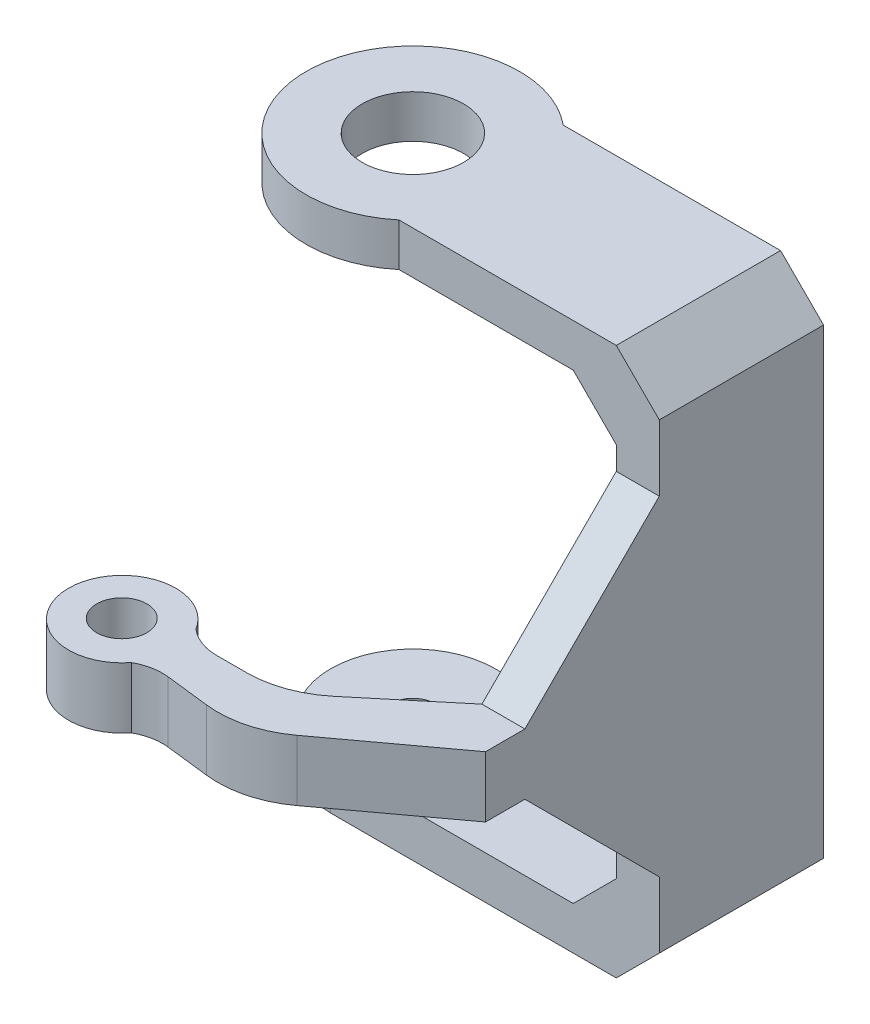
from build123d import *

# Parameters (mm, degrees)
BOSS_EXTRUDE1_DEPTH      = 5.73
BOSS_EXTRUDE1_DEPTH_BACK = 5.73
BOSS_EXTRUDE2_DEPTH      = 11.46
BOSS_EXTRUDE3_DEPTH      = 11.46
BOSS_EXTRUDE4_DEPTH      = 2.999321
SKETCH7_R                = 3.54
CUT_EXTRUDE2_DEPTH       = 2.999322
BOSS_EXTRUDE5_DEPTH      = 3
SKETCH11_R               = 1.52
CUT_EXTRUDE3_DEPTH       = 3
BOSS_EXTRUDE6_DEPTH      = 3.000001
BOSS_EXTRUDE7_DEPTH      = 4.24753
SKETCH15_R               = 1.75
CUT_EXTRUDE4_DEPTH       = 4.24753


with BuildPart() as part:
    # Sketch1 → Boss-Extrude1 (new, two sides: drawn at the far end of the back side and taken through both)
    with BuildSketch(Plane.XY.offset(-BOSS_EXTRUDE1_DEPTH_BACK)):
        Polygon((32.166139185, 36.798009468), (35.166138746, 39.798007166), (38.166139237, 36.798004811), (38.166139237, 4.578006273), (35.166137814, 1.578006712), (32.166137322, 4.578009067), (35.166137814, 7.578007696), (35.166137814, 33.798008976), align=None)
    extrude(amount=BOSS_EXTRUDE1_DEPTH + BOSS_EXTRUDE1_DEPTH_BACK)

    # Sketch2 → Boss-Extrude2 (add)
    with BuildSketch(Plane.XY.offset(5.73)):
        Polygon((32.166139185, 36.798009468), (20.006139185, 36.798009468), (20.006139185, 39.797331447), (32.166139185, 39.797331447), (35.165463026, 39.797331447), align=None)
    extrude(amount=-BOSS_EXTRUDE2_DEPTH)

    # Sketch3 → Boss-Extrude3 (add)
    with BuildSketch(Plane.XY.offset(5.73)):
        Polygon((32.166137322, 4.578009067), (35.166137814, 1.578006712), (32.166137322, 1.578006712), (20.006137322, 1.578006712), (20.006137322, 4.578009067), align=None)
    extrude(amount=-BOSS_EXTRUDE3_DEPTH)

    # Sketch4 → Boss-Extrude4 (add)
    with BuildSketch(Plane(origin=(0, 39.797331447, 0), x_dir=(1, 0, 0), z_dir=(0, 1, 0))):
        with BuildLine():
            Line((20.006139185, 5.73), (20.006139185, -5.73))
            ThreePointArc((20.006139185, -5.73), (7.794878848, 0), (20.006139185, 5.73))
        make_face()
    extrude(amount=-BOSS_EXTRUDE4_DEPTH)

    # Sketch7 → Cut-Extrude2 (cut)
    with BuildSketch(Plane(origin=(0, 39.797331447, 0), x_dir=(1, 0, 0), z_dir=(0, 1, 0))):
        with Locations(Location((15.244878848, 0, 0), (0, 0, 270))):
            Circle(SKETCH7_R)
    extrude(amount=-CUT_EXTRUDE2_DEPTH, mode=Mode.SUBTRACT)

    # Sketch9 → Boss-Extrude5 (add)
    with BuildSketch(Plane(origin=(0, 1.578006712, 0), x_dir=(-1, 0, 0), z_dir=(0, -1, 0))):
        with BuildLine():
            Line((-20.006139185, -5.73), (-15.244878848, -5.73))
            ThreePointArc((-15.244878848, -5.73), (-9.514878848, 0), (-15.244878848, 5.73))
            Line((-15.244878848, 5.73), (-20.006137322, 5.73))
            Line((-20.006137322, 5.73), (-20.006139185, -5.73))
        make_face()
    extrude(amount=-BOSS_EXTRUDE5_DEPTH)

    # Sketch11 → Cut-Extrude3 (cut)
    with BuildSketch(Plane(origin=(0, 1.578006712, 0), x_dir=(-1, 0, 0), z_dir=(0, -1, 0))):
        with Locations(Location((-15.244878848, 0, 0), (0, 0, 90))):
            Circle(SKETCH11_R)
    extrude(amount=-CUT_EXTRUDE3_DEPTH, mode=Mode.SUBTRACT)

    # Sketch12 → Boss-Extrude6 (add)
    with BuildSketch(Plane(origin=(38.166139237, 0, 0), x_dir=(0, 0, -1), z_dir=(1, 0, 0))):
        Polygon((-5.73, 32.188009468), (-5.73, 9.188006273), (-15.106235919, 18.564242191), (-15.106235919, 22.811773549), align=None)
    extrude(amount=-BOSS_EXTRUDE6_DEPTH)

    # Sketch14 → Boss-Extrude7 (add)
    with BuildSketch(Plane(origin=(0, 18.564244712, 0), x_dir=(-1, 0, 0), z_dir=(0, -1, 0))):
        with BuildLine():
            Line((-38.166139237, -15.106235919), (-38.166139237, -17.856235919))
            Line((-38.166139237, -17.856235919), (-30.594801522, -23.440347499))
            ThreePointArc((-30.594801522, -23.440347499), (-28.233323063, -24.573172743), (-25.620768045, -24.758725505))
            Line((-25.620768045, -24.758725505), (-22.565521767, -24.398737054))
            ThreePointArc((-22.565521767, -24.398737054), (-21.460785016, -24.442412716), (-20.423400376, -24.824752827))
            ThreePointArc((-20.423400376, -24.824752827), (-13.74802539, -22.300713773), (-20.66830721, -20.556837667))
            ThreePointArc((-20.66830721, -20.556837667), (-21.746000534, -21.192615252), (-22.977558626, -21.413750285))
            Line((-22.977558626, -21.413750285), (-25.055666544, -21.413750285))
            ThreePointArc((-25.055666544, -21.413750285), (-27.436600146, -20.996390727), (-29.53361792, -19.794080338))
            Line((-29.53361792, -19.794080338), (-35.166137814, -15.106235919))
            Line((-35.166137814, -15.106235919), (-38.166139237, -15.106235919))
        make_face()
    extrude(amount=-BOSS_EXTRUDE7_DEPTH)

    # Sketch15 → Cut-Extrude4 (cut)
    with BuildSketch(Plane(origin=(0, 18.564244712, 0), x_dir=(-1, 0, 0), z_dir=(0, -1, 0))):
        with Locations(Location((-17.41764683, -22.48214533, 0), (0, 0, 90))):
            Circle(SKETCH15_R)
    extrude(amount=-CUT_EXTRUDE4_DEPTH, mode=Mode.SUBTRACT)


solid = part.part
